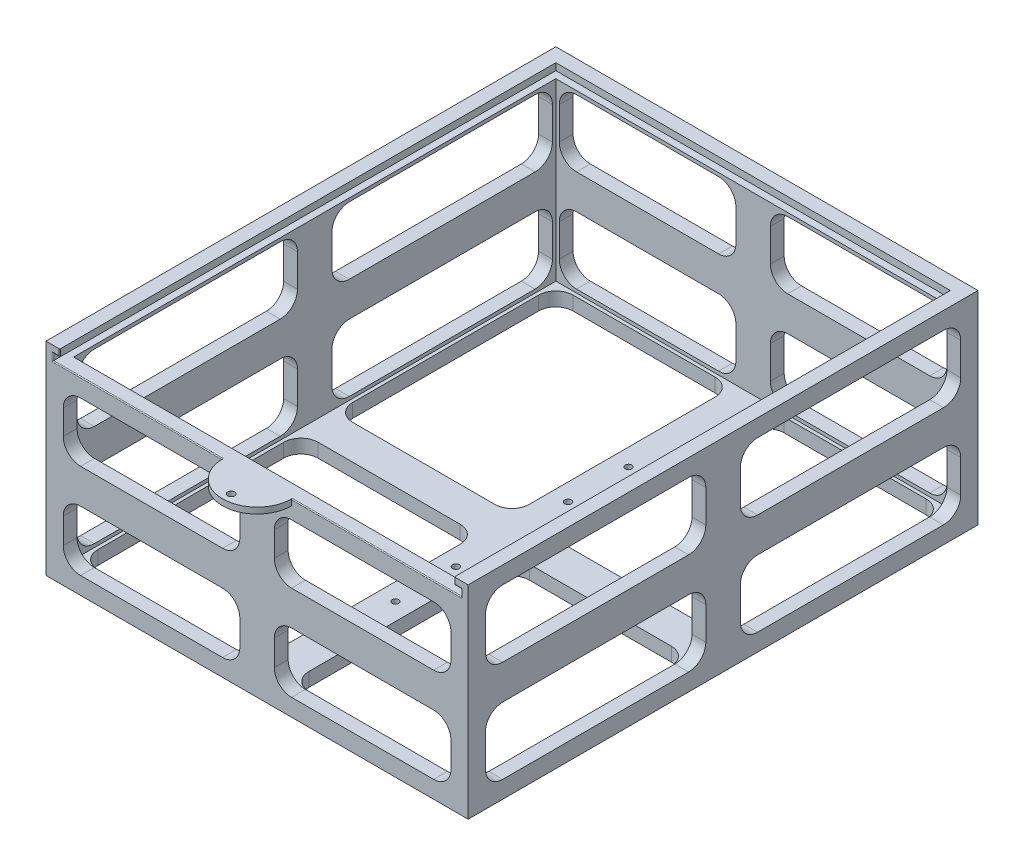
from build123d import *

# Parameters (mm, degrees)
SKETCH1_W           = 244.6
SKETCH1_H           = 295.4
BOSS_EXTRUDE1_DEPTH = 117.6
SHELL1_T            = -8
SKETCH8_W           = 228.6
SKETCH8_H           = 8
CUT_EXTRUDE1_DEPTH  = 8
SKETCH9_W           = 236.6
SKETCH9_H           = 4
CUT_EXTRUDE2_DEPTH  = 291.4
BOSS_EXTRUDE2_DEPTH = 3.5
SKETCH12_R          = 2
CUT_EXTRUDE3_DEPTH  = 3.5
FILLET1_R           = 0.5
SKETCH13_W          = 14.5
SKETCH13_H          = 45
BOSS_EXTRUDE3_DEPTH = 8
SKETCH14_R          = 1.95
CUT_EXTRUDE4_DEPTH  = 8
CUT_EXTRUDE5_DEPTH  = 300
CUT_EXTRUDE6_DEPTH  = 8
CUT_EXTRUDE7_DEPTH  = 8
CUT_EXTRUDE8_START  = -8
CUT_EXTRUDE8_DEPTH  = 8


with BuildPart() as part:
    # Sketch1 → Boss-Extrude1 (new body)
    with BuildSketch(Plane(origin=(0, 0, 0), x_dir=(1, 0, 0), z_dir=(0, 1, 0))):
        Rectangle(SKETCH1_W, SKETCH1_H)
    extrude(amount=BOSS_EXTRUDE1_DEPTH)

    # Shell1
    shell1_openings = [part.faces().sort_by_distance(p)[0] for p in [
        (0, 117.6, 0),
    ]]
    offset(amount=SHELL1_T, openings=shell1_openings, kind=Kind.INTERSECTION)

    # Sketch8 → Cut-Extrude1 (cut)
    with BuildSketch(Plane.XY.offset(147.7)):
        with Locations((0, 113.6)):
            Rectangle(SKETCH8_W, SKETCH8_H)
    extrude(amount=-CUT_EXTRUDE1_DEPTH, mode=Mode.SUBTRACT)

    # Sketch9 → Cut-Extrude2 (cut)
    with BuildSketch(Plane.XY.offset(147.7)):
        with Locations((0, 111.6)):
            Rectangle(SKETCH9_W, SKETCH9_H)
    extrude(amount=-CUT_EXTRUDE2_DEPTH, mode=Mode.SUBTRACT)

    # Sketch10 → Boss-Extrude2 (add)
    with BuildSketch(Plane(origin=(0, 109.6, 0), x_dir=(1, 0, 0), z_dir=(0, 1, 0))):
        with BuildLine():
            Line((-20, -147.7), (20, -147.7))
            ThreePointArc((20, -147.7), (0, -167.7), (-20, -147.7))
        make_face()
    extrude(amount=-BOSS_EXTRUDE2_DEPTH)

    # Sketch12 → Cut-Extrude3 (cut)
    with BuildSketch(Plane(origin=(0, 109.6, 0), x_dir=(1, 0, 0), z_dir=(0, 1, 0))):
        with Locations(Location((0, -162.7, 0), (0, 0, 270))):
            Circle(SKETCH12_R)
    extrude(amount=-CUT_EXTRUDE3_DEPTH, mode=Mode.SUBTRACT)

    # Fillet1
    fillet1_edges = [part.edges().sort_by_distance(p)[0] for p in [
        (-114.3, 115.6, 147.7),
        (-69.15, 109.6, 147.7),
        (114.3, 115.6, 147.7),
        (116.3, 113.6, 147.7),
        (118.3, 111.6, 147.7),
        (-116.3, 113.6, 147.7),
        (-118.3, 111.6, 147.7),
        (69.15, 109.6, 147.7),
    ]]
    fillet(fillet1_edges, radius=FILLET1_R)

    # Sketch13 → Boss-Extrude3 (add)
    with BuildSketch(Plane.XZ):
        with Locations((0, -50)):
            Rectangle(SKETCH13_W, SKETCH13_H)
        with Locations((0, 50)):
            Rectangle(SKETCH13_W, SKETCH13_H)
    extrude(amount=-BOSS_EXTRUDE3_DEPTH)

    # Sketch14 → Cut-Extrude4 (cut)
    with BuildSketch(Plane.XZ):
        with Locations(Location((0, 67.5, 0), (0, 0, 270))):
            Circle(SKETCH14_R)
        with Locations(Location((0, 32.5, 0), (0, 0, 270))):
            Circle(SKETCH14_R)
        with Locations(Location((0, -32.5, 0), (0, 0, 270))):
            Circle(SKETCH14_R)
        with Locations(Location((0, -67.5, 0), (0, 0, 270))):
            Circle(SKETCH14_R)
    extrude(amount=-CUT_EXTRUDE4_DEPTH, mode=Mode.SUBTRACT)

    # Sketch16 → Cut-Extrude5 (cut)
    with BuildSketch(Plane.ZY.offset(122.3)):
        with BuildLine():
            Line((-127.7, 107.6), (-20, 107.6))
            ThreePointArc((-20, 107.6), (-12.928932188, 104.671067812), (-10, 97.6))
            Line((-10, 97.6), (-10, 78.8))
            ThreePointArc((-10, 78.8), (-12.928932188, 71.728932188), (-20, 68.8))
            Line((-20, 68.8), (-127.7, 68.8))
            ThreePointArc((-127.7, 68.8), (-134.771067812, 71.728932188), (-137.7, 78.8))
            Line((-137.7, 78.8), (-137.7, 97.6))
            ThreePointArc((-137.7, 97.6), (-134.771067812, 104.671067812), (-127.7, 107.6))
        make_face()
        with BuildLine():
            Line((-127.7, 48.8), (-20, 48.8))
            ThreePointArc((-20, 48.8), (-12.928932188, 45.871067812), (-10, 38.8))
            Line((-10, 38.8), (-10, 20))
            ThreePointArc((-10, 20), (-12.928932188, 12.928932188), (-20, 10))
            Line((-20, 10), (-127.7, 10))
            ThreePointArc((-127.7, 10), (-134.771067812, 12.928932188), (-137.7, 20))
            Line((-137.7, 20), (-137.7, 38.8))
            ThreePointArc((-137.7, 38.8), (-134.771067812, 45.871067812), (-127.7, 48.8))
        make_face()
        with BuildLine():
            Line((20, 107.6), (127.7, 107.6))
            ThreePointArc((127.7, 107.6), (134.771067812, 104.671067812), (137.7, 97.6))
            Line((137.7, 97.6), (137.7, 78.8))
            ThreePointArc((137.7, 78.8), (134.771067812, 71.728932188), (127.7, 68.8))
            Line((127.7, 68.8), (20, 68.8))
            ThreePointArc((20, 68.8), (12.928932188, 71.728932188), (10, 78.8))
            Line((10, 78.8), (10, 97.6))
            ThreePointArc((10, 97.6), (12.928932188, 104.671067812), (20, 107.6))
        make_face()
        with BuildLine():
            Line((20, 48.8), (127.7, 48.8))
            ThreePointArc((127.7, 48.8), (134.771067812, 45.871067812), (137.7, 38.8))
            Line((137.7, 38.8), (137.7, 20))
            ThreePointArc((137.7, 20), (134.771067812, 12.928932188), (127.7, 10))
            Line((127.7, 10), (20, 10))
            ThreePointArc((20, 10), (12.928932188, 12.928932188), (10, 20))
            Line((10, 20), (10, 38.8))
            ThreePointArc((10, 38.8), (12.928932188, 45.871067812), (20, 48.8))
        make_face()
    extrude(amount=-CUT_EXTRUDE5_DEPTH, mode=Mode.SUBTRACT)

    # Sketch17 → Cut-Extrude6 (cut)
    with BuildSketch(Plane(origin=(0, 0, -147.7), x_dir=(-1, 0, 0), z_dir=(0, 0, -1))):
        with BuildLine():
            Line((-102.3, 107.6), (-20, 107.6))
            ThreePointArc((-20, 107.6), (-12.928932188, 104.671067812), (-10, 97.6))
            Line((-10, 97.6), (-10, 78.8))
            ThreePointArc((-10, 78.8), (-12.928932188, 71.728932188), (-20, 68.8))
            Line((-20, 68.8), (-102.3, 68.8))
            ThreePointArc((-102.3, 68.8), (-109.371067812, 71.728932188), (-112.3, 78.8))
            Line((-112.3, 78.8), (-112.3, 97.6))
            ThreePointArc((-112.3, 97.6), (-109.371067812, 104.671067812), (-102.3, 107.6))
        make_face()
        with BuildLine():
            Line((-102.3, 48.8), (-20, 48.8))
            ThreePointArc((-20, 48.8), (-12.928932188, 45.871067812), (-10, 38.8))
            Line((-10, 38.8), (-10, 20))
            ThreePointArc((-10, 20), (-12.928932188, 12.928932188), (-20, 10))
            Line((-20, 10), (-102.3, 10))
            ThreePointArc((-102.3, 10), (-109.371067812, 12.928932188), (-112.3, 20))
            Line((-112.3, 20), (-112.3, 38.8))
            ThreePointArc((-112.3, 38.8), (-109.371067812, 45.871067812), (-102.3, 48.8))
        make_face()
        with BuildLine():
            Line((20, 107.6), (102.3, 107.6))
            ThreePointArc((102.3, 107.6), (109.371067812, 104.671067812), (112.3, 97.6))
            Line((112.3, 97.6), (112.3, 78.8))
            ThreePointArc((112.3, 78.8), (109.371067812, 71.728932188), (102.3, 68.8))
            Line((102.3, 68.8), (20, 68.8))
            ThreePointArc((20, 68.8), (12.928932188, 71.728932188), (10, 78.8))
            Line((10, 78.8), (10, 97.6))
            ThreePointArc((10, 97.6), (12.928932188, 104.671067812), (20, 107.6))
        make_face()
        with BuildLine():
            Line((20, 48.8), (102.3, 48.8))
            ThreePointArc((102.3, 48.8), (109.371067812, 45.871067812), (112.3, 38.8))
            Line((112.3, 38.8), (112.3, 20))
            ThreePointArc((112.3, 20), (109.371067812, 12.928932188), (102.3, 10))
            Line((102.3, 10), (20, 10))
            ThreePointArc((20, 10), (12.928932188, 12.928932188), (10, 20))
            Line((10, 20), (10, 38.8))
            ThreePointArc((10, 38.8), (12.928932188, 45.871067812), (20, 48.8))
        make_face()
    extrude(amount=-CUT_EXTRUDE6_DEPTH, mode=Mode.SUBTRACT)

    # Sketch18 → Cut-Extrude7 (cut)
    with BuildSketch(Plane.XZ):
        with BuildLine():
            Line((-102.3, 137.7), (-20, 137.7))
            ThreePointArc((-20, 137.7), (-12.928932188, 134.771067812), (-10, 127.7))
            Line((-10, 127.7), (-10, 20))
            ThreePointArc((-10, 20), (-12.928932188, 12.928932188), (-20, 10))
            Line((-20, 10), (-102.3, 10))
            ThreePointArc((-102.3, 10), (-109.371067812, 12.928932188), (-112.3, 20))
            Line((-112.3, 20), (-112.3, 127.7))
            ThreePointArc((-112.3, 127.7), (-109.371067812, 134.771067812), (-102.3, 137.7))
        make_face()
        with BuildLine():
            Line((-102.3, -10), (-20, -10))
            ThreePointArc((-20, -10), (-12.928932188, -12.928932188), (-10, -20))
            Line((-10, -20), (-10, -127.7))
            ThreePointArc((-10, -127.7), (-12.928932188, -134.771067812), (-20, -137.7))
            Line((-20, -137.7), (-102.3, -137.7))
            ThreePointArc((-102.3, -137.7), (-109.371067812, -134.771067812), (-112.3, -127.7))
            Line((-112.3, -127.7), (-112.3, -20))
            ThreePointArc((-112.3, -20), (-109.371067812, -12.928932188), (-102.3, -10))
        make_face()
        with BuildLine():
            Line((20, 137.7), (102.3, 137.7))
            ThreePointArc((102.3, 137.7), (109.371067812, 134.771067812), (112.3, 127.7))
            Line((112.3, 127.7), (112.3, 20))
            ThreePointArc((112.3, 20), (109.371067812, 12.928932188), (102.3, 10))
            Line((102.3, 10), (20, 10))
            ThreePointArc((20, 10), (12.928932188, 12.928932188), (10, 20))
            Line((10, 20), (10, 127.7))
            ThreePointArc((10, 127.7), (12.928932188, 134.771067812), (20, 137.7))
        make_face()
        with BuildLine():
            Line((20, -10), (102.3, -10))
            ThreePointArc((102.3, -10), (109.371067812, -12.928932188), (112.3, -20))
            Line((112.3, -20), (112.3, -127.7))
            ThreePointArc((112.3, -127.7), (109.371067812, -134.771067812), (102.3, -137.7))
            Line((102.3, -137.7), (20, -137.7))
            ThreePointArc((20, -137.7), (12.928932188, -134.771067812), (10, -127.7))
            Line((10, -127.7), (10, -20))
            ThreePointArc((10, -20), (12.928932188, -12.928932188), (20, -10))
        make_face()
    extrude(amount=-CUT_EXTRUDE7_DEPTH, mode=Mode.SUBTRACT)

    # Sketch19 → Cut-Extrude8 (cut)
    with BuildSketch(Plane.XY.offset(147.7).offset(CUT_EXTRUDE8_START)):
        with BuildLine():
            Line((-102.3, 99.1), (-20, 99.1))
            ThreePointArc((-20, 99.1), (-12.928932188, 96.171067812), (-10, 89.1))
            Line((-10, 89.1), (-10, 74.8))
            ThreePointArc((-10, 74.8), (-12.928932188, 67.728932188), (-20, 64.8))
            Line((-20, 64.8), (-102.3, 64.8))
            ThreePointArc((-102.3, 64.8), (-109.371067812, 67.728932188), (-112.3, 74.8))
            Line((-112.3, 74.8), (-112.3, 89.1))
            ThreePointArc((-112.3, 89.1), (-109.371067812, 96.171067812), (-102.3, 99.1))
        make_face()
        with BuildLine():
            Line((20, 99.1), (102.3, 99.1))
            ThreePointArc((102.3, 99.1), (109.371067812, 96.171067812), (112.3, 89.1))
            Line((112.3, 89.1), (112.3, 74.8))
            ThreePointArc((112.3, 74.8), (109.371067812, 67.728932188), (102.3, 64.8))
            Line((102.3, 64.8), (20, 64.8))
            ThreePointArc((20, 64.8), (12.928932188, 67.728932188), (10, 74.8))
            Line((10, 74.8), (10, 89.1))
            ThreePointArc((10, 89.1), (12.928932188, 96.171067812), (20, 99.1))
        make_face()
        with BuildLine():
            Line((-102.3, 44.8), (-20, 44.8))
            ThreePointArc((-20, 44.8), (-12.928932188, 41.871067812), (-10, 34.8))
            Line((-10, 34.8), (-10, 20))
            ThreePointArc((-10, 20), (-12.928932188, 12.928932188), (-20, 10))
            Line((-20, 10), (-102.3, 10))
            ThreePointArc((-102.3, 10), (-109.371067812, 12.928932188), (-112.3, 20))
            Line((-112.3, 20), (-112.3, 34.8))
            ThreePointArc((-112.3, 34.8), (-109.371067812, 41.871067812), (-102.3, 44.8))
        make_face()
        with BuildLine():
            Line((20, 44.8), (102.3, 44.8))
            ThreePointArc((102.3, 44.8), (109.371067812, 41.871067812), (112.3, 34.8))
            Line((112.3, 34.8), (112.3, 20))
            ThreePointArc((112.3, 20), (109.371067812, 12.928932188), (102.3, 10))
            Line((102.3, 10), (20, 10))
            ThreePointArc((20, 10), (12.928932188, 12.928932188), (10, 20))
            Line((10, 20), (10, 34.8))
            ThreePointArc((10, 34.8), (12.928932188, 41.871067812), (20, 44.8))
        make_face()
    extrude(amount=CUT_EXTRUDE8_DEPTH, mode=Mode.SUBTRACT)


solid = part.part
